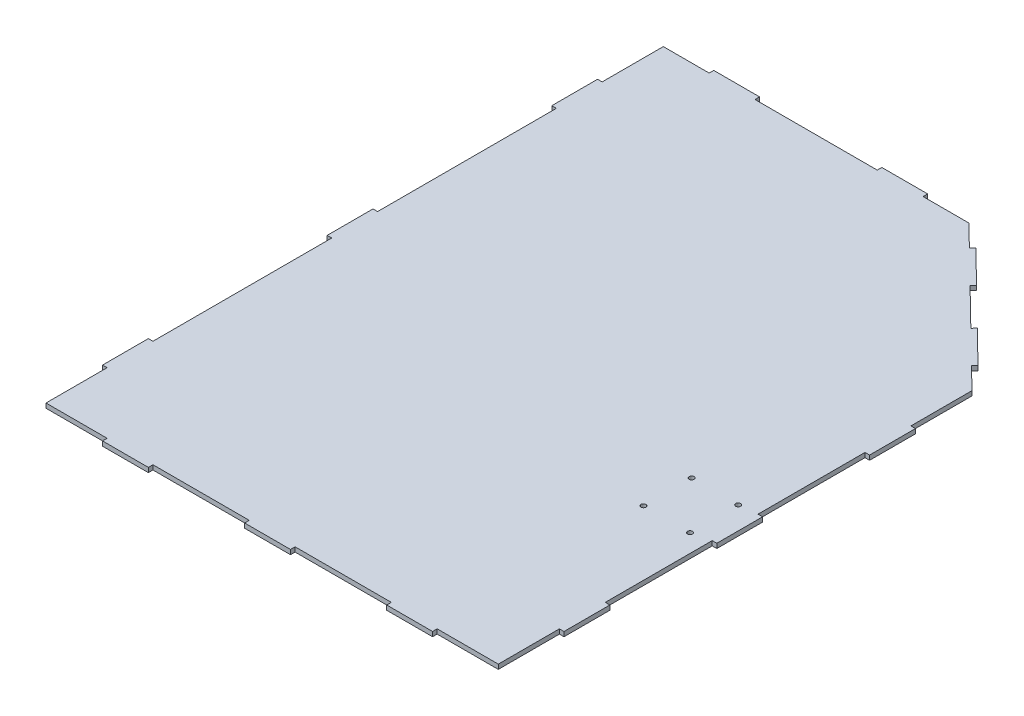
from build123d import *

# Parameters (mm, degrees)
SKETCH1_R           = 1.6
BOSS_EXTRUDE1_DEPTH = 3


with BuildPart() as part:
    # Sketch1 → Boss-Extrude1 (new body)
    with BuildSketch(Plane(origin=(0, 0, 0), x_dir=(1, 0, 0), z_dir=(0, 1, 0))):
        Polygon((0, 0), (0, 40), (-3, 40), (-3, 70), (0, 70), (0, 187), (-3, 187), (-3, 217), (0, 217), (0, 334), (-3, 334), (-3, 364), (0, 364), (0, 404), (30, 404), (30, 407), (60, 407), (60, 404), (140, 404), (140, 407), (170, 407), (170, 404), (200, 404), (214.29020853, 390.007504148), (216.389082908, 392.151035427), (237.824395702, 371.162291649), (235.725521325, 369.01876037), (260.274478675, 344.98123963), (262.373353053, 347.12477091), (283.808665848, 326.136027132), (281.70979147, 323.992495852), (296, 310), (296, 270), (299, 270), (299, 240), (296, 240), (296, 170), (299, 170), (299, 140), (296, 140), (296, 70), (299, 70), (299, 40), (296, 40), (296, 0), (256, 0), (256, -3), (226, -3), (226, 0), (163, 0), (163, -3), (133, -3), (133, 0), (70, 0), (70, -3), (40, -3), (40, 0), align=None)
        with Locations(Location((253.75, 168.75, 0), (0, 0, 270))):
            Circle(SKETCH1_R, mode=Mode.SUBTRACT)
        with Locations(Location((284.25, 168.75, 0), (0, 0, 270))):
            Circle(SKETCH1_R, mode=Mode.SUBTRACT)
        with Locations(Location((284.25, 137.25, 0), (0, 0, 270))):
            Circle(SKETCH1_R, mode=Mode.SUBTRACT)
        with Locations(Location((253.75, 137.25, 0), (0, 0, 270))):
            Circle(SKETCH1_R, mode=Mode.SUBTRACT)
    extrude(amount=BOSS_EXTRUDE1_DEPTH)


solid = part.part
